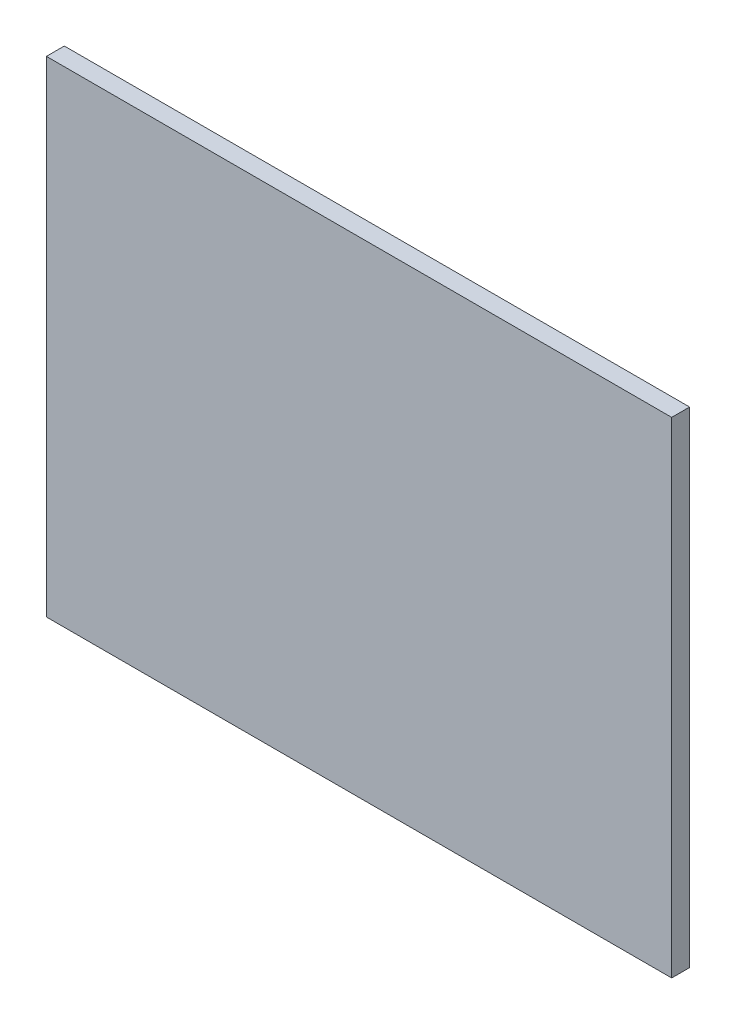
from build123d import *

# Parameters (mm, degrees)
SKETCH2_W           = 69.8
SKETCH2_H           = 54.2
BOSS_EXTRUDE3_DEPTH = 2


with BuildPart() as part:
    # Sketch2 → Boss-Extrude3 (new body)
    with BuildSketch(Plane.XY):
        with Locations((34.9, 27.1)):
            Rectangle(SKETCH2_W, SKETCH2_H)
    extrude(amount=BOSS_EXTRUDE3_DEPTH)


solid = part.part
